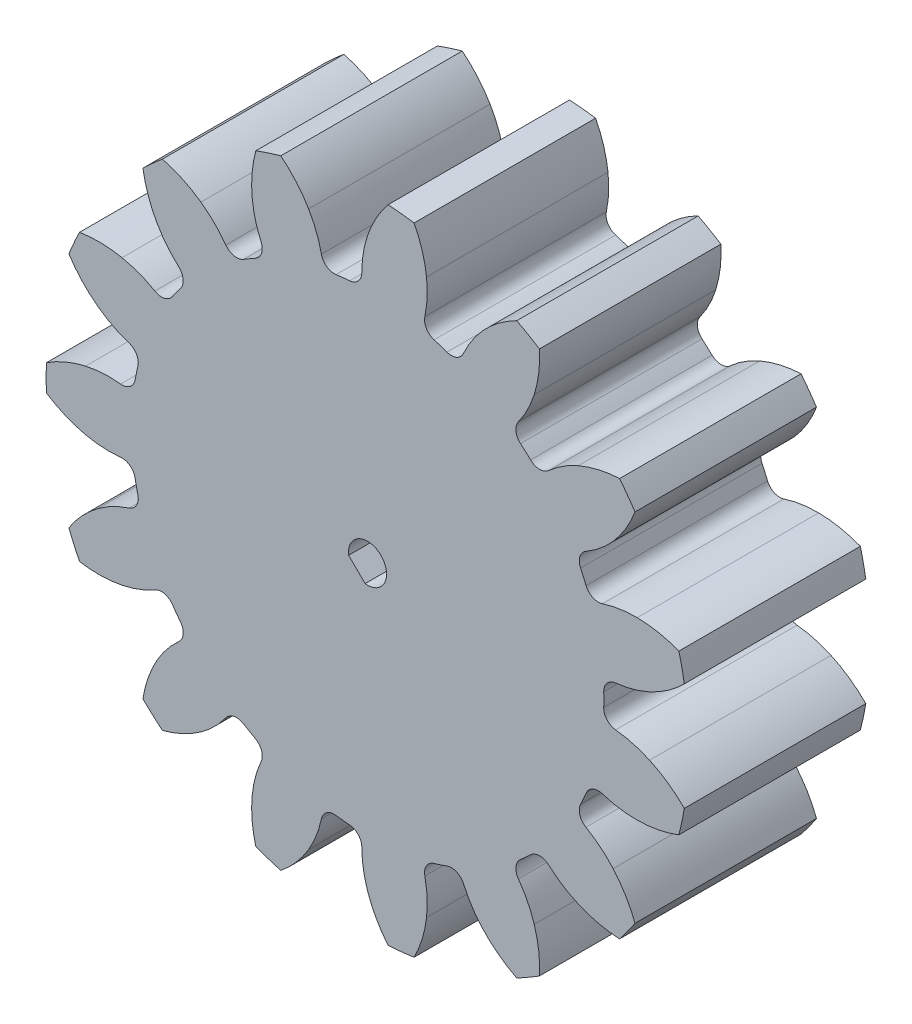
from build123d import *

# Parameters (mm, degrees)
SKETCH1_R          = 26.9875
GEAR_BASE_DEPTH    = 7.62
GEAR_CUT_DEPTH     = 42.096324805
GEAR_TEETH_COUNT   = 15
CUT_EXTRUDE1_DEPTH = 42.060162735


with BuildPart() as part:
    # Sketch1 → GEAR_BASE (new, symmetric)
    with BuildSketch(Plane.XY):
        Circle(SKETCH1_R)
    extrude(amount=GEAR_BASE_DEPTH, both=True)

    # Sketch2 → GEAR_CUT (cut, through all)
    with BuildSketch(Plane.XY.offset(7.62)):
        with BuildLine():
            ThreePointArc((-25.081599898, -9.961852378), (-26.397758375, -5.611016756), (-26.965032052, -1.101000756))
            ThreePointArc((-26.965032052, -1.101000756), (-25.386045792, -1.945419828), (-23.681539378, -2.4939625))
            ThreePointArc((-23.681539378, -2.4939625), (-22.214193273, -2.699568669), (-20.732987425, -2.662049009))
            ThreePointArc((-20.732987425, -2.662049009), (-19.948924355, -2.876360551), (-19.520504813, -3.567114509))
            ThreePointArc((-19.520504813, -3.567114509), (-19.410116452, -4.125747615), (-19.283744683, -4.680983342))
            ThreePointArc((-19.283744683, -4.680983342), (-19.394170464, -5.486272409), (-20.023279363, -6.000962926))
            ThreePointArc((-20.023279363, -6.000962926), (-21.391688858, -6.569147705), (-22.648548664, -7.353801716))
            ThreePointArc((-22.648548664, -7.353801716), (-23.982580351, -8.5482056), (-25.081599898, -9.961852378))
        make_face()
    gear_cut = extrude(amount=-GEAR_CUT_DEPTH, mode=Mode.SUBTRACT)

    # GEAR_TEETH: GEAR_CUT ×15 about axis
    gear_teeth_axis = Axis((0, 0, -1.397), (0, 0, 1))
    for i in range(1, GEAR_TEETH_COUNT):
        add(gear_cut.rotate(gear_teeth_axis, i * 360 / GEAR_TEETH_COUNT), mode=Mode.SUBTRACT)

    # Sketch3 → Cut-Extrude1 (cut, through all)
    with BuildSketch(Plane.XY.offset(7.62)):
        with BuildLine():
            ThreePointArc((1.6002, 0), (-0.107920049, 1.596556702), (-1.585643398, -0.215348678))
            Line((-1.585643398, -0.215348678), (-0.203935482, -1.58715165))
            ThreePointArc((-0.203935482, -1.58715165), (1.056953755, -1.201452787), (1.6002, 0))
        make_face()
    extrude(amount=-CUT_EXTRUDE1_DEPTH, mode=Mode.SUBTRACT)


solid = part.part
